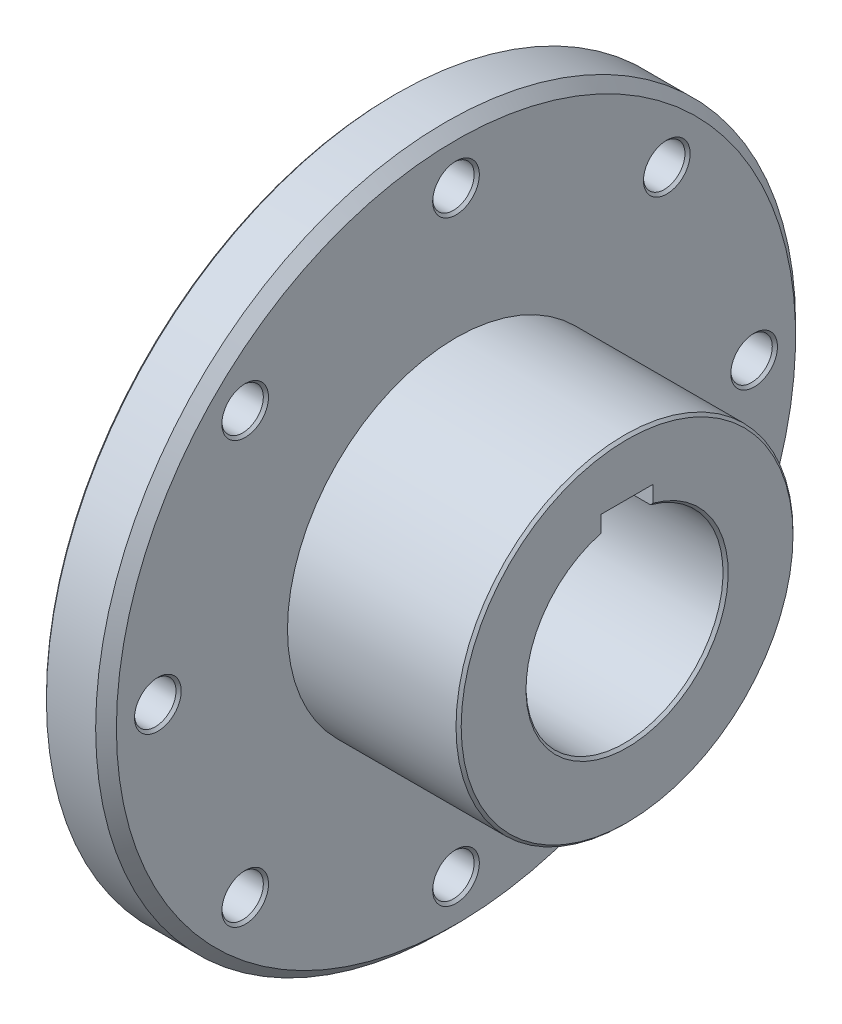
from build123d import *

# Parameters (mm, degrees)
SKETCH_2_W          = 10
SKETCH_2_H          = 22
CUT_EXTRUDE_1_DEPTH = 111.170322683
SKETCH_3_R          = 4
CUT_EXTRUDE_2_DEPTH = 102.002475217
CHAMFER_1_SIZE      = 2
CHAMFER_2_SIZE      = 1
CHAMFER_3_SIZE      = 0.5


with BuildPart() as part:
    # 草图1 → 旋转1 (revolve)
    with BuildSketch(Plane.XY, mode=Mode.PRIVATE) as revolve_1_sk:
        Polygon((0, 19), (0, 32.5), (10, 32.5), (10, 67.5), (22, 67.5), (22, 32.5), (55, 32.5), (55, 19), align=None)
    revolve(revolve_1_sk.sketch.rotate(Axis((0, 0, 0), (1, 0, 0)), 90), axis=Axis((0, 0, 0), (1, 0, 0)))

    # 草图2 → 切除-拉伸1 (cut, through all)
    with BuildSketch(Plane(origin=(55, 0, 0), x_dir=(0, 0, -1), z_dir=(1, 0, 0))):
        with Locations((0, 11)):
            Rectangle(SKETCH_2_W, SKETCH_2_H)
    extrude(amount=-CUT_EXTRUDE_1_DEPTH, mode=Mode.SUBTRACT)

    # 草图3 → 切除-拉伸2 (cut, through all)
    with BuildSketch(Plane(origin=(22, 0, 0), x_dir=(0, 0, -1), z_dir=(1, 0, 0))):
        with Locations((0, 57.5)):
            Circle(SKETCH_3_R)
        with Locations((40.658639918, 40.658639918)):
            Circle(SKETCH_3_R)
        with Locations((57.5, 0)):
            Circle(SKETCH_3_R)
        with Locations((40.658639918, -40.658639918)):
            Circle(SKETCH_3_R)
        with Locations((0, -57.5)):
            Circle(SKETCH_3_R)
        with Locations((-40.658639918, -40.658639918)):
            Circle(SKETCH_3_R)
        with Locations((-57.5, 0)):
            Circle(SKETCH_3_R)
        with Locations((-40.658639918, 40.658639918)):
            Circle(SKETCH_3_R)
    extrude(amount=-CUT_EXTRUDE_2_DEPTH, mode=Mode.SUBTRACT)

    # 倒角1
    chamfer_1_edges = [part.edges().sort_by_distance(p)[0] for p in [
        (22, 0, -67.5),
    ]]
    chamfer(chamfer_1_edges, length=CHAMFER_1_SIZE)

    # 倒角2
    chamfer_2_edges = [part.edges().sort_by_distance(p)[0] for p in [
        (0, -19, 0),
    ]]
    chamfer(chamfer_2_edges, length=CHAMFER_2_SIZE)

    # 倒角3
    chamfer_3_edges = [part.edges().sort_by_distance(p)[0] for p in [
        (55, -19, 0),
        (10, 57.5, 4),
        (22, 57.5, 4),
        (10, 40.658639918, -36.658639918),
        (22, 40.658639918, -36.658639918),
        (10, 0, -53.5),
        (22, 0, -53.5),
        (10, -40.658639918, -36.658639918),
        (22, -40.658639918, -36.658639918),
        (10, -57.5, 4),
        (22, -57.5, 4),
        (10, -40.658639918, 44.658639918),
        (22, -40.658639918, 44.658639918),
        (10, 0, 61.5),
        (22, 0, 61.5),
        (10, 40.658639918, 44.658639918),
        (22, 40.658639918, 44.658639918),
        (55, 0, -32.5),
        (10, 0, -67.5),
    ]]
    chamfer(chamfer_3_edges, length=CHAMFER_3_SIZE)


solid = part.part
